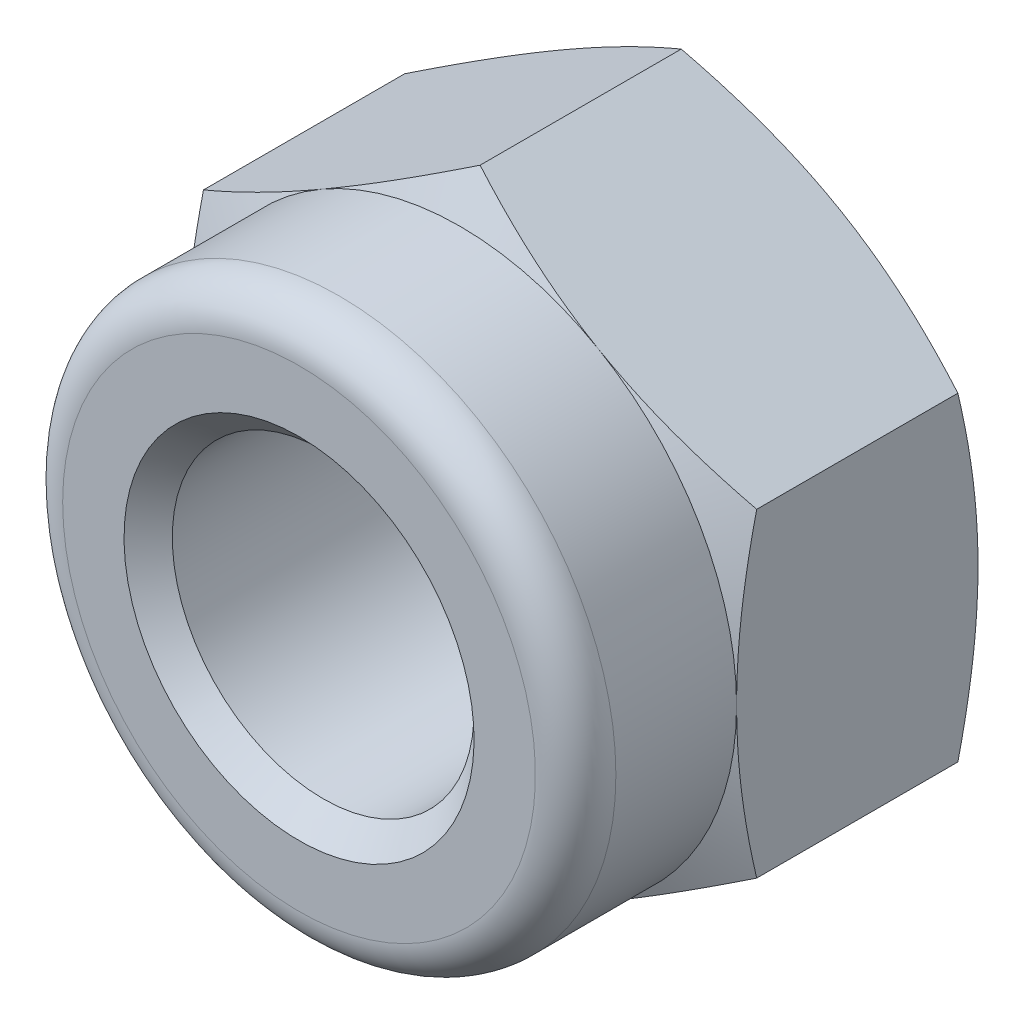
from build123d import *

# Parameters (mm, degrees)
SKETCH1_R           = 1.5
BOSS_EXTRUDE1_DEPTH = 2.4


with BuildPart() as part:
    # Sketch1 → Boss-Extrude1 (new body)
    with BuildSketch(Plane.XY):
        Polygon((0, -3.175426481), (2.75, -1.58771324), (2.75, 1.58771324), (0, 3.175426481), (-2.75, 1.58771324), (-2.75, -1.58771324), align=None)
        Circle(SKETCH1_R, mode=Mode.SUBTRACT)
    extrude(amount=BOSS_EXTRUDE1_DEPTH)

    # Sketch3 → Revolve1 (revolve)
    with BuildSketch(Plane(origin=(0, 0, 0), x_dir=(0, 0, -1), z_dir=(0, 1, 0))):
        with BuildLine():
            Line((-2.4, 2.75), (-3.6, 2.75))
            ThreePointArc((-3.6, 2.75), (-3.882842712, 2.632842712), (-4, 2.35))
            Line((-4, 2.35), (-4, 1.5))
            Line((-4, 1.5), (-2.4, 1.5))
            Line((-2.4, 1.5), (-2.4, 2.75))
        make_face()
    revolve(axis=Axis((0, 0, 0), (0, 0, 1)))

    # Sketch2 → Cut-Revolve1 (revolve, cut)
    with BuildSketch(Plane(origin=(0, 0, 0), x_dir=(0, 0, -1), z_dir=(1, 0, 0))):
        Polygon((-2.4, 3.175426481), (-2.4, 2.75), (-2.2, 3.175426481), align=None)
        Polygon((-0.2, 3.175426481), (0, 3.175426481), (0, 2.75), align=None)
        Polygon((-4, 1.5), (-3.76, 1.5), (-4, 1.74), align=None)
        Polygon((0, 1.5), (-0.24, 1.5), (0, 1.74), align=None)
    revolve(axis=Axis((0, 0, 0), (0, 0, 1)), mode=Mode.SUBTRACT)


solid = part.part
